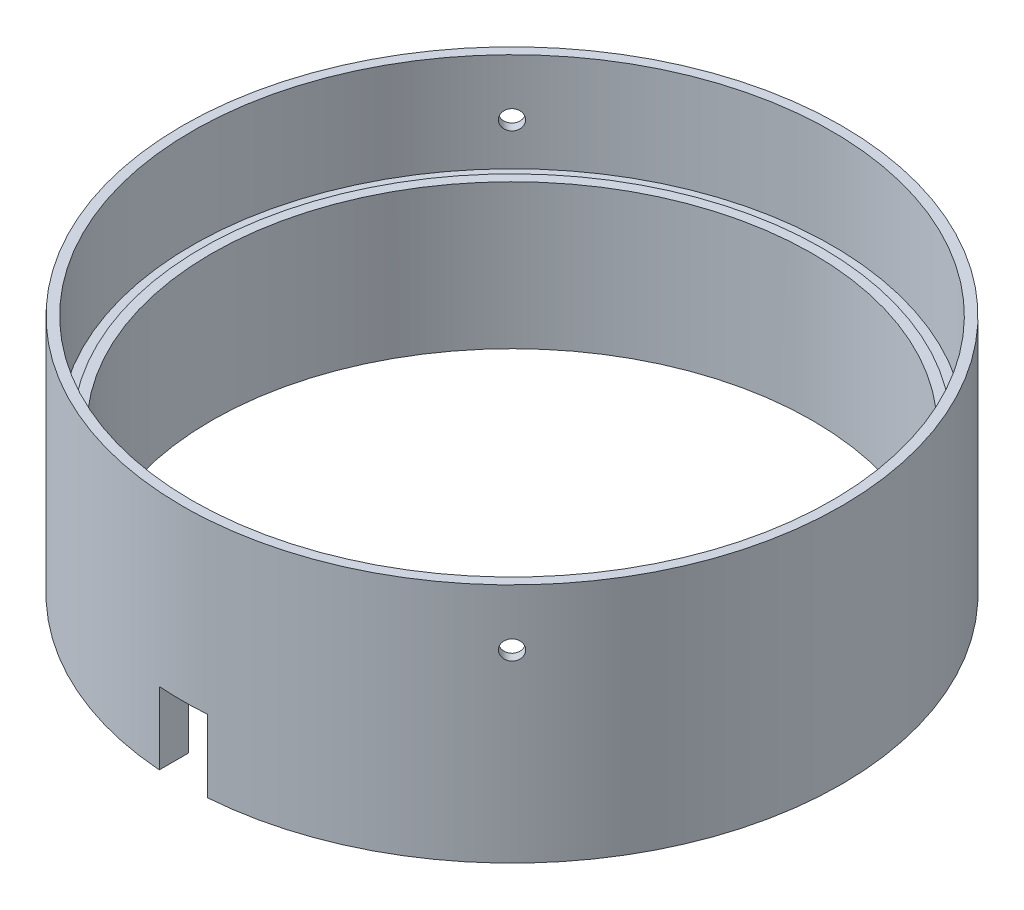
from build123d import *

# Parameters (mm, degrees)
SKETCH1_R                = 68.369999998
SKETCH1_R_2              = 62.369999998
BOSS_EXTRUDE1_DEPTH      = 30
SKETCH68_R               = 68.369999998
SKETCH68_R_2             = 66.369999998
BOSS_EXTRUDE2_DEPTH      = 20
CUT_EXTRUDE8_START       = -0.5
SKETCH69_R               = 66.369999998
SKETCH69_R_2             = 64.369999998
CUT_EXTRUDE8_DEPTH       = 0.5
SKETCH72_W               = 10
SKETCH72_H               = 15
CUT_EXTRUDE9_DEPTH       = 129.553881543
CUT_EXTRUDE12_DEPTH      = 122.552738517
CUT_EXTRUDE12_DEPTH_BACK = 122.552738517
SKETCH75_R               = 2
CUT_EXTRUDE13_DEPTH      = 127.128190531
CUT_EXTRUDE13_DEPTH_BACK = 127.128190531
SKETCH76_R               = 2.000000001


with BuildPart() as part:
    # Sketch1 → Boss-Extrude1 (new body)
    with BuildSketch(Plane(origin=(0, 0, 0), x_dir=(-0.9985653746512714, 0, -0.053546172109368295), z_dir=(0, 1, 0))):
        with Locations(Location((29.226008494, -15.877583489, 0), (0, 0, 93.069437642))):
            Circle(SKETCH1_R)
        with Locations(Location((29.226008494, -15.877583489, 0), (0, 0, 93.069437642))):
            Circle(SKETCH1_R_2, mode=Mode.SUBTRACT)
    extrude(amount=BOSS_EXTRUDE1_DEPTH)

    # Sketch68 → Boss-Extrude2 (add)
    with BuildSketch(Plane(origin=(0, 30, 0), x_dir=(1, 0, 0), z_dir=(0, 1, 0))):
        with Locations(Location((-28.333896303, 17.419745986, 0), (0, 0, 270))):
            Circle(SKETCH68_R)
        with Locations(Location((-28.333896303, 17.419745986, 0), (0, 0, 270))):
            Circle(SKETCH68_R_2, mode=Mode.SUBTRACT)
    extrude(amount=BOSS_EXTRUDE2_DEPTH)

    # Sketch69 → Cut-Extrude8 (cut)
    with BuildSketch(Plane(origin=(0, 30, 0), x_dir=(1, 0, 0), z_dir=(0, 1, 0)).offset(CUT_EXTRUDE8_START)):
        with Locations(Location((-28.333896303, 17.419745986, 0), (0, 0, 270))):
            Circle(SKETCH69_R)
        with Locations(Location((-28.333896303, 17.419745986, 0), (0, 0, 270))):
            Circle(SKETCH69_R_2, mode=Mode.SUBTRACT)
    extrude(amount=CUT_EXTRUDE8_DEPTH, mode=Mode.SUBTRACT)

    # Sketch72 → Cut-Extrude9 (cut, through all)
    with BuildSketch(Plane(origin=(0, 0, -17.419745986), x_dir=(-1, 0, 0), z_dir=(0, 0, -1))):
        with Locations((28.333896303, 7.5)):
            Rectangle(SKETCH72_W, SKETCH72_H)
    extrude(amount=-CUT_EXTRUDE9_DEPTH, mode=Mode.SUBTRACT)

    # Sketch75 → Cut-Extrude12 (cut, two sides: drawn at the far end of the back side and taken through both)
    with BuildSketch(Plane(origin=(-27.926429367, 72.899932993, -17.0123656), x_dir=(0.7071818832479886, 0, 0.7070316711476428), z_dir=(-0.7070316711476428, 0, 0.7071818832479886)).offset(-CUT_EXTRUDE12_DEPTH_BACK)):
        with Locations(Location((-0.576184071, -34.599932993, 0), (0, 0, 180))):
            Circle(SKETCH75_R)
    extrude(amount=CUT_EXTRUDE12_DEPTH + CUT_EXTRUDE12_DEPTH_BACK, mode=Mode.SUBTRACT)

    # Sketch76 → Cut-Extrude13 (cut, two sides: drawn at the far end of the back side and taken through both)
    with BuildSketch(Plane(origin=(-32.743645602, 72.899932993, -13.009059816), x_dir=(0.7070316711476428, 0, -0.7071818832479886), z_dir=(0.7071818832479886, 0, 0.7070316711476428)).offset(-CUT_EXTRUDE13_DEPTH_BACK)):
        with Locations((6.236989769, -34.599932997)):
            Circle(SKETCH76_R)
    extrude(amount=CUT_EXTRUDE13_DEPTH + CUT_EXTRUDE13_DEPTH_BACK, mode=Mode.SUBTRACT)


solid = part.part
